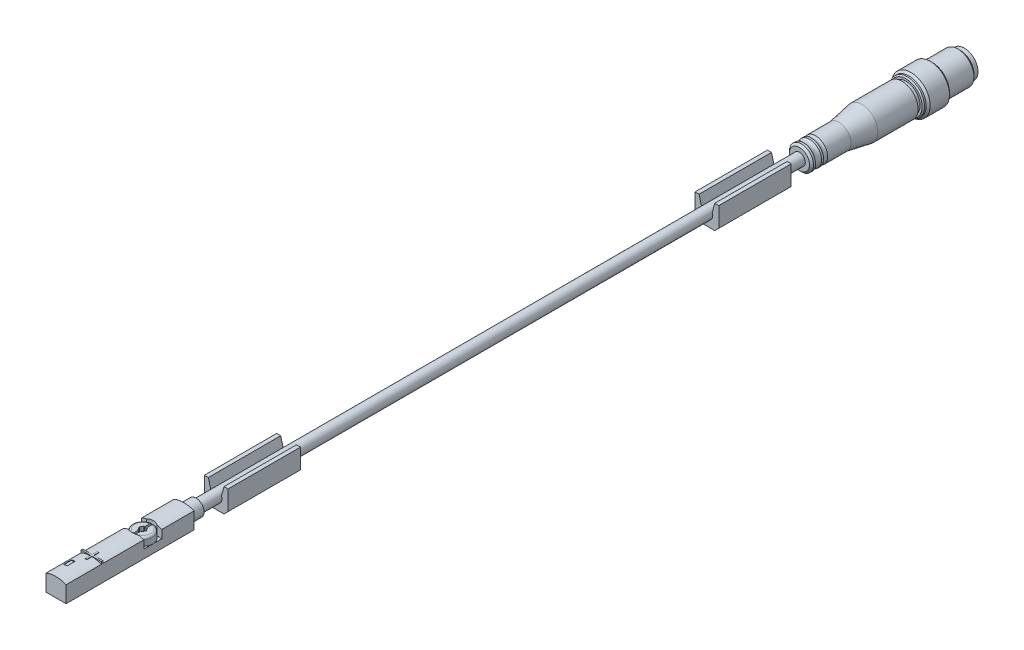
from build123d import *

# Parameters (mm, degrees)
LINEAR_AUSTRAGEN1_DEPTH      = 31.8
SKIZZE2_W                    = 3
SKIZZE2_H                    = 2
LINEAR_AUSTRAGEN2_DEPTH      = 2
SKIZZE4_W                    = 150
SKIZZE4_H                    = 1.45
LINEAR_START                 = -18
LINEAR_AUSTRAGEN3_DEPTH      = 18
LINEAR_AUSTRAGEN4_DEPTH      = 18
LINEAR_AUSTRAGEN5_DEPTH      = 0.5
LINEAR_AUSTRAGEN5_DEPTH_BACK = 0.5
SKIZZE8_W                    = 1
SKIZZE8_H                    = 2
LINEAR_AUSTRAGEN6_DEPTH      = 2.6
LINEAR_START_2               = -2.1
LINEAR_AUSTRAGEN7_DEPTH      = 2.1


with BuildPart() as part:
    # Skizze1 → Linear austragen1 (new body)
    with BuildSketch(Plane.XY):
        with BuildLine():
            Line((-2.5, -2.1), (2.5, -2.1))
            Line((2.5, -2.1), (2.5, 2))
            ThreePointArc((2.5, 2), (0, 2.5), (-2.5, 2))
            Line((-2.5, 2), (-2.5, -2.1))
        make_face()
    extrude(amount=LINEAR_AUSTRAGEN1_DEPTH)

    # Skizze2 → Rotation1 (revolve)
    with BuildSketch(Plane(origin=(0, 0, 0), x_dir=(0, 0, -1), z_dir=(1, 0, 0)), mode=Mode.PRIVATE) as rotation1_sk:
        with Locations((1.5, 1)):
            Rectangle(SKIZZE2_W, SKIZZE2_H)
    revolve(rotation1_sk.sketch.rotate(Axis((0, 0, -3), (0, 0, 1)), 270), axis=Axis((0, 0, -3), (0, 0, 1)))

    # Skizze3 → Linear austragen2 (add)
    with BuildSketch(Plane(origin=(0, 2.6, 0), x_dir=(-1, 0, 0), z_dir=(0, 1, 0))):
        Polygon((2.5, 23.05), (0.2, 23.05), (0.2, 24.35), (-0.2, 24.35), (-0.2, 23.05), (-2.5, 23.05), (-2.5, 22.65), (-0.2, 22.65), (-0.2, 21.35), (0.2, 21.35), (0.2, 22.65), (2.5, 22.65), align=None)
    extrude(amount=-LINEAR_AUSTRAGEN2_DEPTH)

    # Skizze4 → Rotation2 (revolve)
    with BuildSketch(Plane(origin=(0, 0, 0), x_dir=(0, 0, -1), z_dir=(1, 0, 0)), mode=Mode.PRIVATE) as rotation2_sk:
        with Locations((78, 0.725)):
            Rectangle(SKIZZE4_W, SKIZZE4_H)
    revolve(rotation2_sk.sketch.rotate(Axis((0, 0, -153), (0, 0, 1)), 270), axis=Axis((0, 0, -153), (0, 0, 1)))

    # Skizze5 → Linear austragen3 (add)
    with BuildSketch(Plane.XY.offset(-8).offset(LINEAR_START)):
        with BuildLine():
            Line((-2.95, 2.95), (-2.95, -1.95))
            Line((-2.95, -1.95), (-1.95, -2.95))
            Line((-1.95, -2.95), (1.95, -2.95))
            Line((1.95, -2.95), (2.95, -1.95))
            Line((2.95, -1.95), (2.95, 2.95))
            Line((2.95, 2.95), (1.95, 2.95))
            Line((1.95, 2.95), (1.320214964, 0.599610248))
            ThreePointArc((1.320214964, 0.599610248), (0, -1.45), (-1.320214964, 0.599610248))
            Line((-1.320214964, 0.599610248), (-1.95, 2.95))
            Line((-1.95, 2.95), (-2.95, 2.95))
        make_face()
    extrude(amount=LINEAR_AUSTRAGEN3_DEPTH)

    # Skizze6 → Linear austragen4 (add)
    with BuildSketch(Plane.XY.offset(-148)):
        with BuildLine():
            Line((-2.95, 2.95), (-2.95, -1.95))
            Line((-2.95, -1.95), (-1.95, -2.95))
            Line((-1.95, -2.95), (1.95, -2.95))
            Line((1.95, -2.95), (2.95, -1.95))
            Line((2.95, -1.95), (2.95, 2.95))
            Line((2.95, 2.95), (1.95, 2.95))
            Line((1.95, 2.95), (1.320214964, 0.599610248))
            ThreePointArc((1.320214964, 0.599610248), (0, -1.45), (-1.320214964, 0.599610248))
            Line((-1.320214964, 0.599610248), (-1.95, 2.95))
            Line((-1.95, 2.95), (-2.95, 2.95))
        make_face()
    extrude(amount=LINEAR_AUSTRAGEN4_DEPTH)

    # Skizze7 → Rotation3 (revolve)
    with BuildSketch(Plane(origin=(0, 0, 0), x_dir=(0, 0, -1), z_dir=(1, 0, 0)), mode=Mode.PRIVATE) as rotation3_sk:
        with BuildLine():
            Line((153, 0), (153, 2.5))
            Line((153, 2.5), (153.5, 3))
            Line((153.5, 3), (154, 3))
            ThreePointArc((154, 3), (154.75, 2.799038106), (155.5, 3))
            Line((155.5, 3), (156, 3))
            ThreePointArc((156, 3), (156.5, 2.866025404), (157, 3))
            Line((157, 3), (162.82871818, 3))
            Line((162.82871818, 3), (168.5, 4))
            Line((168.5, 4), (178.5, 4))
            Line((178.5, 4), (178.5, 3.5))
            Line((178.5, 3.5), (179.5, 3.5))
            Line((179.5, 3.5), (179.5, 4))
            Line((179.5, 4), (179.8, 4.3))
            Line((179.8, 4.3), (180.2, 4.3))
            Line((180.2, 4.3), (180.7, 4.8))
            Line((180.7, 4.8), (185.5, 4.8))
            Line((185.5, 4.8), (186, 4.3))
            Line((186, 4.3), (186, 4))
            Line((186, 4), (192.3865, 4))
            Line((192.3865, 4), (193, 3.3865))
            Line((193, 3.3865), (194, 3.3865))
            Line((194, 3.3865), (194, 0))
            Line((194, 0), (153, 0))
        make_face()
    revolve(rotation3_sk.sketch.rotate(Axis((0, 0, -194), (0, 0, 1)), 270), axis=Axis((0, 0, -194), (0, 0, 1)))

    # Skizze8 → Linear austragen5 (cut, two sides: drawn at the far end of the back side and taken through both)
    with BuildSketch(Plane(origin=(0, 2.6, 0), x_dir=(-1, 0, 0), z_dir=(0, 1, 0)).offset(-LINEAR_AUSTRAGEN5_DEPTH_BACK)):
        with Locations((1.5, 27)):
            Rectangle(SKIZZE8_W, SKIZZE8_H)
    extrude(amount=LINEAR_AUSTRAGEN5_DEPTH + LINEAR_AUSTRAGEN5_DEPTH_BACK, mode=Mode.SUBTRACT)

    # Skizze9 → Linear austragen6 (cut)
    with BuildSketch(Plane(origin=(0, 2.6, 0), x_dir=(-1, 0, 0), z_dir=(0, 1, 0))):
        with BuildLine():
            Line((5, 8), (5, 12.5))
            Line((5, 12.5), (1.302881422, 12.5))
            ThreePointArc((1.302881422, 12.5), (0, 12.85), (-1.302881422, 12.5))
            Line((-1.302881422, 12.5), (-5, 12.5))
            Line((-5, 12.5), (-5, 8))
            Line((-5, 8), (-1.302881422, 8))
            ThreePointArc((-1.302881422, 8), (0, 7.65), (1.302881422, 8))
            Line((1.302881422, 8), (5, 8))
        make_face()
    extrude(amount=-LINEAR_AUSTRAGEN6_DEPTH, mode=Mode.SUBTRACT)

    # Skizze10 → Rotation4 (revolve)
    with BuildSketch(Plane(origin=(0, 0, 0), x_dir=(0, 0, -1), z_dir=(1, 0, 0)), mode=Mode.PRIVATE) as rotation4_sk:
        with BuildLine():
            Line((-10.25, 2), (-8.25, 2))
            ThreePointArc((-8.25, 2), (-7.896446609, 1.853553391), (-7.75, 1.5))
            Line((-7.75, 1.5), (-7.75, 0))
            Line((-7.75, 0), (-10.25, 0))
            Line((-10.25, 0), (-10.25, 2))
        make_face()
    revolve(rotation4_sk.sketch.rotate(Axis((0, 0, 10.25), (0, 1, 0)), 180), axis=Axis((0, 0, 10.25), (0, 1, 0)))

    # Skizze11 → Linear austragen7 (cut)
    with BuildSketch(Plane(origin=(0, 2.6, 0), x_dir=(-1, 0, 0), z_dir=(0, 1, 0)).offset(LINEAR_START_2)):
        with BuildLine():
            Line((0.866025404, 10.25), (0.433012702, 11))
            Line((0.433012702, 11), (0.25, 11))
            Line((0.25, 11), (0.25, 12.737468593))
            ThreePointArc((0.25, 12.737468593), (0, 12.75), (-0.25, 12.737468593))
            Line((-0.25, 12.737468593), (-0.25, 11))
            Line((-0.25, 11), (-0.433012702, 11))
            Line((-0.433012702, 11), (-0.866025404, 10.25))
            Line((-0.866025404, 10.25), (-0.433012702, 9.5))
            Line((-0.433012702, 9.5), (-0.25, 9.5))
            Line((-0.25, 9.5), (-0.25, 7.762531407))
            ThreePointArc((-0.25, 7.762531407), (0, 7.75), (0.25, 7.762531407))
            Line((0.25, 7.762531407), (0.25, 9.5))
            Line((0.25, 9.5), (0.433012702, 9.5))
            Line((0.433012702, 9.5), (0.866025404, 10.25))
        make_face()
    extrude(amount=LINEAR_AUSTRAGEN7_DEPTH, mode=Mode.SUBTRACT)


solid = part.part
